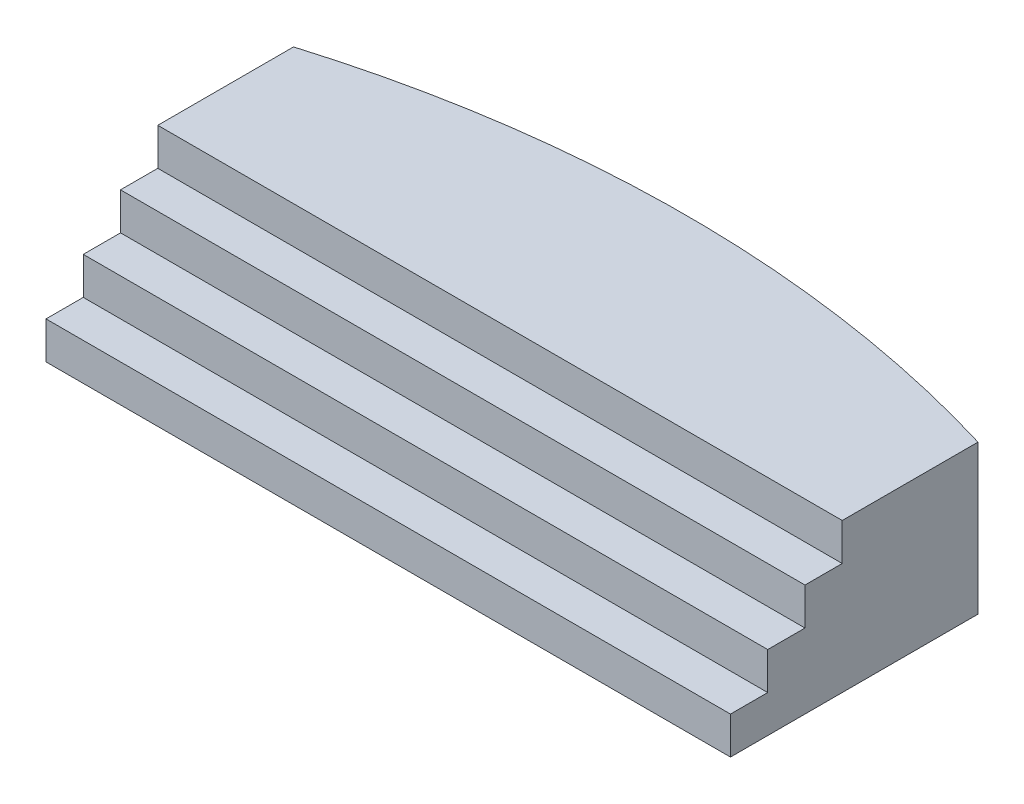
from build123d import *

# Parameters (mm, degrees)
SKETCH2_R           = 7945.75
BOSS_EXTRUDE1_DEPTH = 1000
SKETCH3_OUTSIDE_W   = 20392.742
SKETCH3_OUTSIDE_H   = 20392.742
SKETCH3_OUTSIDE_W_2 = 4592.7878
SKETCH3_OUTSIDE_H_2 = 4000
CUT_EXTRUDE1_DEPTH  = 1000
CUT_EXTRUDE2_DEPTH  = 5000


with BuildPart() as part:
    # Sketch2 → Boss-Extrude1 (new body)
    with BuildSketch(Plane(origin=(0, 0, 0), x_dir=(1, 0, 0), z_dir=(0, 1, 0))):
        with Locations(Location((0, 0, 0), (0, 0, 270))):
            Circle(SKETCH2_R)
    extrude(amount=BOSS_EXTRUDE1_DEPTH)

    # Sketch3 outside → Cut-Extrude1 (cut)
    with BuildSketch(Plane(origin=(0, 1000, 0), x_dir=(1, 0, 0), z_dir=(0, 1, 0))):
        Rectangle(SKETCH3_OUTSIDE_W, SKETCH3_OUTSIDE_H)
        with Locations((0, 7945.75)):
            Rectangle(SKETCH3_OUTSIDE_W_2, SKETCH3_OUTSIDE_H_2, mode=Mode.SUBTRACT)
    extrude(amount=-CUT_EXTRUDE1_DEPTH, mode=Mode.SUBTRACT)

    # Sketch4 → Cut-Extrude2 (cut)
    with BuildSketch(Plane(origin=(2296.3939, 0, 0), x_dir=(0, 0, -1), z_dir=(1, 0, 0))):
        Polygon((5945.75, 250), (6195.75, 250), (6195.75, 500), (6445.75, 500), (6445.75, 750), (6695.75, 750), (6695.75, 1000), (5945.75, 1000), align=None)
    extrude(amount=-CUT_EXTRUDE2_DEPTH, mode=Mode.SUBTRACT)


solid = part.part
